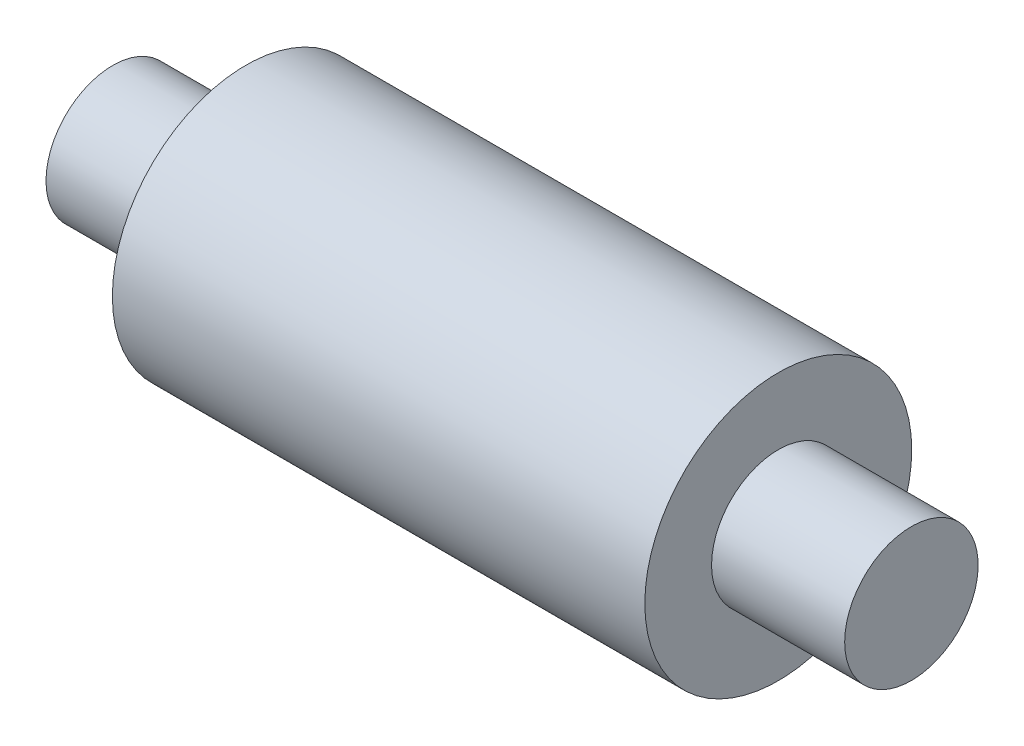
from build123d import *


with BuildPart() as part:
    # Sketch1 → Revolve2 (revolve)
    with BuildSketch(Plane(origin=(0, 0, 0), x_dir=(1, 0, 0), z_dir=(0, 1, 0))):
        Polygon((0, 4.7752), (0, 0), (9.525, 0), (9.525, -4.7752), (47.625, -4.7752), (47.625, 0), (57.15, 0), (57.15, 4.7752), align=None)
    revolve(axis=Axis((0, 0, -4.7752), (1, 0, 0)))


solid = part.part
